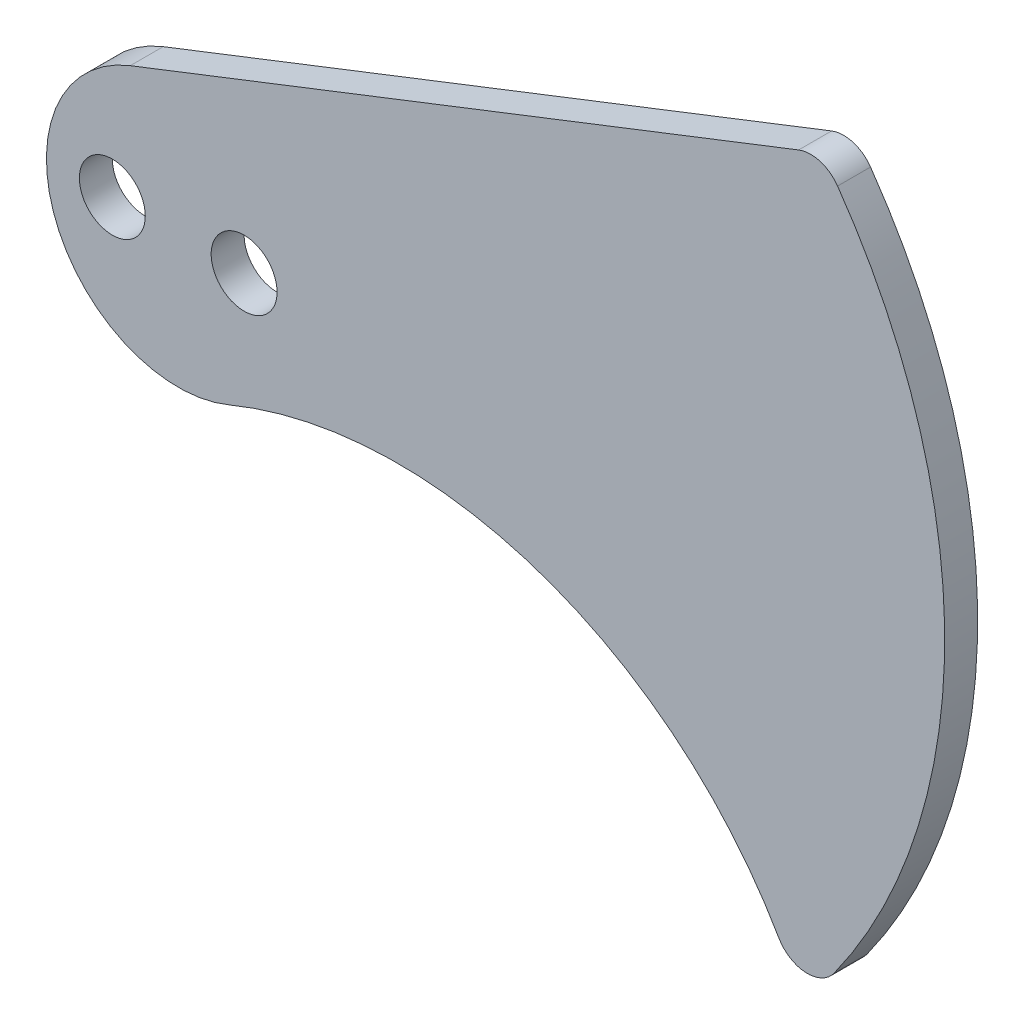
from build123d import *

# Parameters (mm, degrees)
SKETCH1_R           = 3
BOSS_EXTRUDE1_DEPTH = 3


with BuildPart() as part:
    # Sketch1 → Boss-Extrude1 (new body)
    with BuildSketch(Plane(origin=(0, 0, 0), x_dir=(0, 1, 0), z_dir=(0, 0, 1))):
        with BuildLine():
            Line((-0.823178029, 4.367911471), (22.959093686, -56.487309327))
            ThreePointArc((22.959093686, -56.487309327), (23.036789975, -58.446570398), (21.887628759, -60.035333804))
            ThreePointArc((21.887628759, -60.035333804), (-9.269367484, -69.787393269), (-40.327126668, -59.723762055))
            ThreePointArc((-40.327126668, -59.723762055), (-41.576105768, -57.134789232), (-40.074300788, -54.683807619))
            ThreePointArc((-40.074300788, -54.683807619), (-22.12312602, -32.858554253), (-23.076923077, -4.615384615))
            ThreePointArc((-23.076923077, -4.615384615), (-16.491925767, 11.12756051), (-0.823178029, 4.367911471))
        make_face()
        with Locations(Location((-12, 6, 0), (0, 0, 270))):
            Circle(SKETCH1_R, mode=Mode.SUBTRACT)
        with Locations(Location((-12, -6, 0), (0, 0, 270))):
            Circle(SKETCH1_R, mode=Mode.SUBTRACT)
    extrude(amount=BOSS_EXTRUDE1_DEPTH)


solid = part.part
